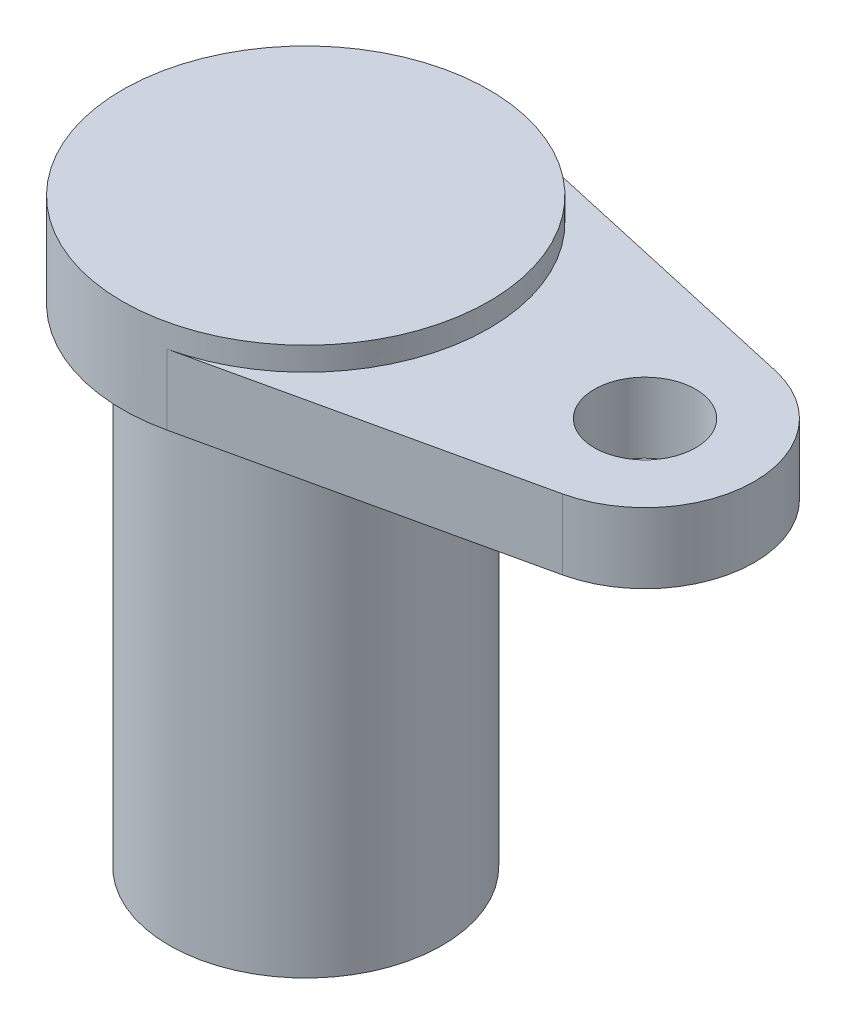
from build123d import *
from build123d.topology import SkipClean

# Parameters (mm, degrees)
SKETCH1_R           = 8.89
BOSS_EXTRUDE1_DEPTH = 31.75
SKETCH2_R           = 3.302
BOSS_EXTRUDE2_DEPTH = 4.572
SKETCH3_R           = 11.938
BOSS_EXTRUDE3_DEPTH = 1.524


with BuildPart() as part:
    # Sketch1 → Boss-Extrude1 (new body)
    with BuildSketch(Plane(origin=(0, 0, 0), x_dir=(1, 0, 0), z_dir=(0, 1, 0))):
        with Locations(Location((0, 0, 0), (0, 0, 270))):
            Circle(SKETCH1_R)
    extrude(amount=BOSS_EXTRUDE1_DEPTH)

    # Sketch2 → Boss-Extrude2 (add)
    with BuildSketch(Plane(origin=(0, 31.75, 0), x_dir=(1, 0, 0), z_dir=(0, 1, 0))):
        with BuildLine():
            Line((2.607149425, 11.649833298), (23.651195402, 6.94032622))
            ThreePointArc((23.651195402, 6.94032622), (29.21, 0), (23.651195402, -6.94032622))
            Line((23.651195402, -6.94032622), (2.607149425, -11.649833298))
            ThreePointArc((2.607149425, -11.649833298), (-11.938, 0), (2.607149425, 11.649833298))
        make_face()
        with Locations(Location((22.098, 0, 0), (0, 0, 270))):
            Circle(SKETCH2_R, mode=Mode.SUBTRACT)
    extrude(amount=BOSS_EXTRUDE2_DEPTH)

    # Sketch3 → Boss-Extrude3 (add)
    with SkipClean():  # the faces are left unmerged after this step: merging them gives an invalid solid
        with BuildSketch(Plane(origin=(0, 36.322, 0), x_dir=(1, 0, 0), z_dir=(0, 1, 0))):
            with Locations(Location((0, 0, 0), (0, 0, 77.385465227))):
                Circle(SKETCH3_R)
        extrude(amount=BOSS_EXTRUDE3_DEPTH)


solid = part.part
